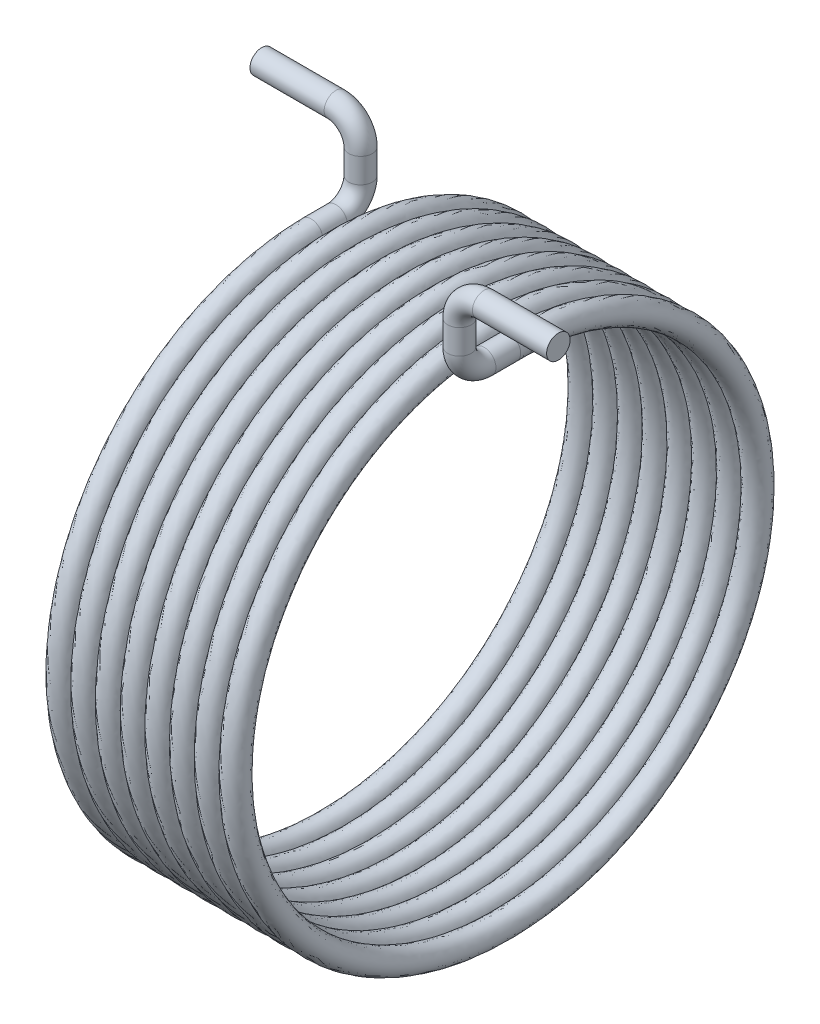
from build123d import *

# Parameters (mm, degrees)
SWEEP1_PITCH       = 1
SWEEP1_HEIGHT      = 8
SWEEP1_RADIUS      = 10.5
SWEEP1_START_ANGLE = -90
SKETCH2_R          = 0.475
SKETCH3_R          = 0.475
SKETCH5_R          = 0.475


with BuildPart() as part:
    # Sweep1: sweep along a helix
    with BuildLine() as sweep1_path:
        add(Helix(SWEEP1_PITCH, SWEEP1_HEIGHT, SWEEP1_RADIUS, center=(-2.5, 0, 0), direction=(1, 0, 0), mode=Mode.PRIVATE).rotate(Axis((-2.5, 0, 0), (1, 0, 0)), SWEEP1_START_ANGLE))
    # Sketch2 → Sweep1 (sweep)
    with BuildSketch(Plane.XY):
        with Locations((-2.469362338, 10.304578214)):
            Circle(SKETCH2_R)
    sweep(path=sweep1_path.line, is_frenet=True)

    # Sweep4: sweep along a curve in space
    with BuildLine() as sweep4_path:
        Line((-2.469362338, 10.304578214, 0), (-2.469362338, 10.304578214, -1))
        ThreePointArc((-2.469362338, 10.304578214, -1), (-2.469362338, 10.597471432, -1.707106781), (-2.469362338, 11.304578214, -2))
        Line((-2.469362338, 11.304578214, -2), (-2.469362338, 12.304578214, -2))
        ThreePointArc((-2.469362338, 12.304578214, -2), (-2.762255557, 13.011684995, -2), (-3.469362338, 13.304578214, -2))
        Line((-3.469362338, 13.304578214, -2), (-6.469362338, 13.304578214, -2))
    # Sketch3 → Sweep4 (sweep)
    with BuildSketch(Plane(origin=(0, 0, 0), x_dir=(-1, 0, 0), z_dir=(0, 0, -1))):
        with Locations((2.469362338, 10.304578214)):
            Circle(SKETCH3_R)
    sweep(path=sweep4_path.line)

    # Sweep5: sweep along a curve in space
    with BuildLine() as sweep5_path:
        Line((5.530637662, 10.304578214, 0), (5.530637662, 10.304578214, 1))
        ThreePointArc((5.530637662, 10.304578214, 1), (5.530637662, 10.597471432, 1.707106781), (5.530637662, 11.304578214, 2))
        Line((5.530637662, 11.304578214, 2), (5.530637662, 12.304578214, 2))
        ThreePointArc((5.530637662, 12.304578214, 2), (5.823530881, 13.011684995, 2), (6.530637662, 13.304578214, 2))
        Line((6.530637662, 13.304578214, 2), (9.530637662, 13.304578214, 2))
    # Sketch5 → Sweep5 (sweep)
    with BuildSketch(Plane.XY):
        with Locations((5.530637662, 10.304578214)):
            Circle(SKETCH5_R)
    sweep(path=sweep5_path.line)


solid = part.part
